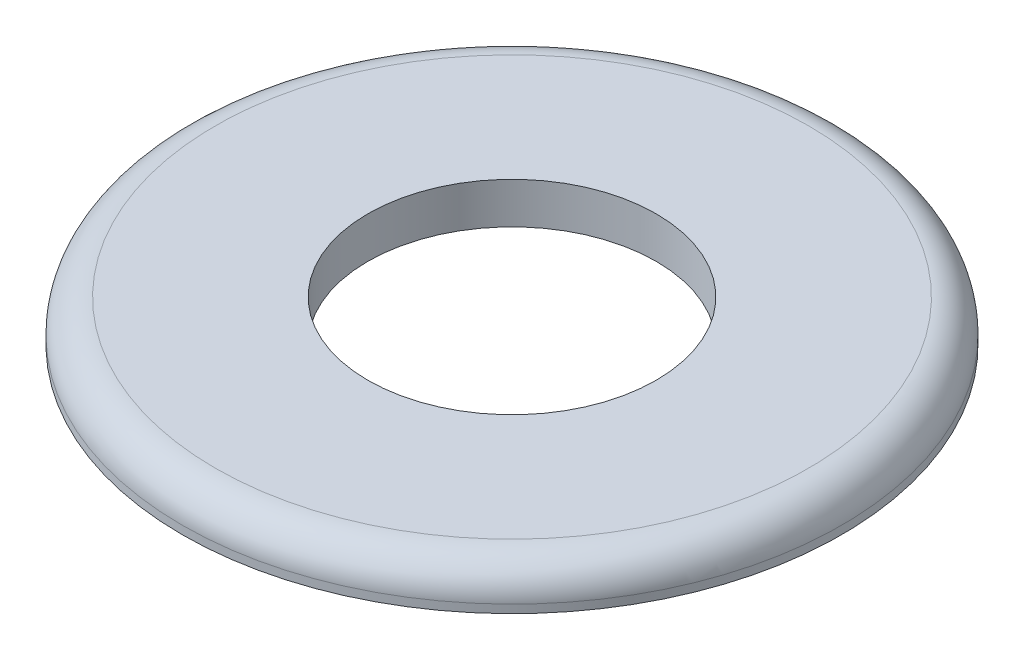
from build123d import *

# Parameters (mm, degrees)
SKETCH_1_R      = 4
SKETCH_1_R_2    = 1.75
EXTRUDE_1_DEPTH = 0.5
FILLET_1_R      = 0.4


with BuildPart() as part:
    # 草图1 → 凸台-拉伸1 (new body)
    with BuildSketch(Plane(origin=(0, 0, 0), x_dir=(1, 0, 0), z_dir=(0, 1, 0))):
        with Locations(Location((0, 0, 0), (0, 0, 270))):
            Circle(SKETCH_1_R)
        with Locations(Location((0, 0, 0), (0, 0, 270))):
            Circle(SKETCH_1_R_2, mode=Mode.SUBTRACT)
    extrude(amount=EXTRUDE_1_DEPTH)

    # 圆角1
    fillet_1_edges = [part.edges().sort_by_distance(p)[0] for p in [
        (0, 0.5, -4),
    ]]
    fillet(fillet_1_edges, radius=FILLET_1_R)


solid = part.part
